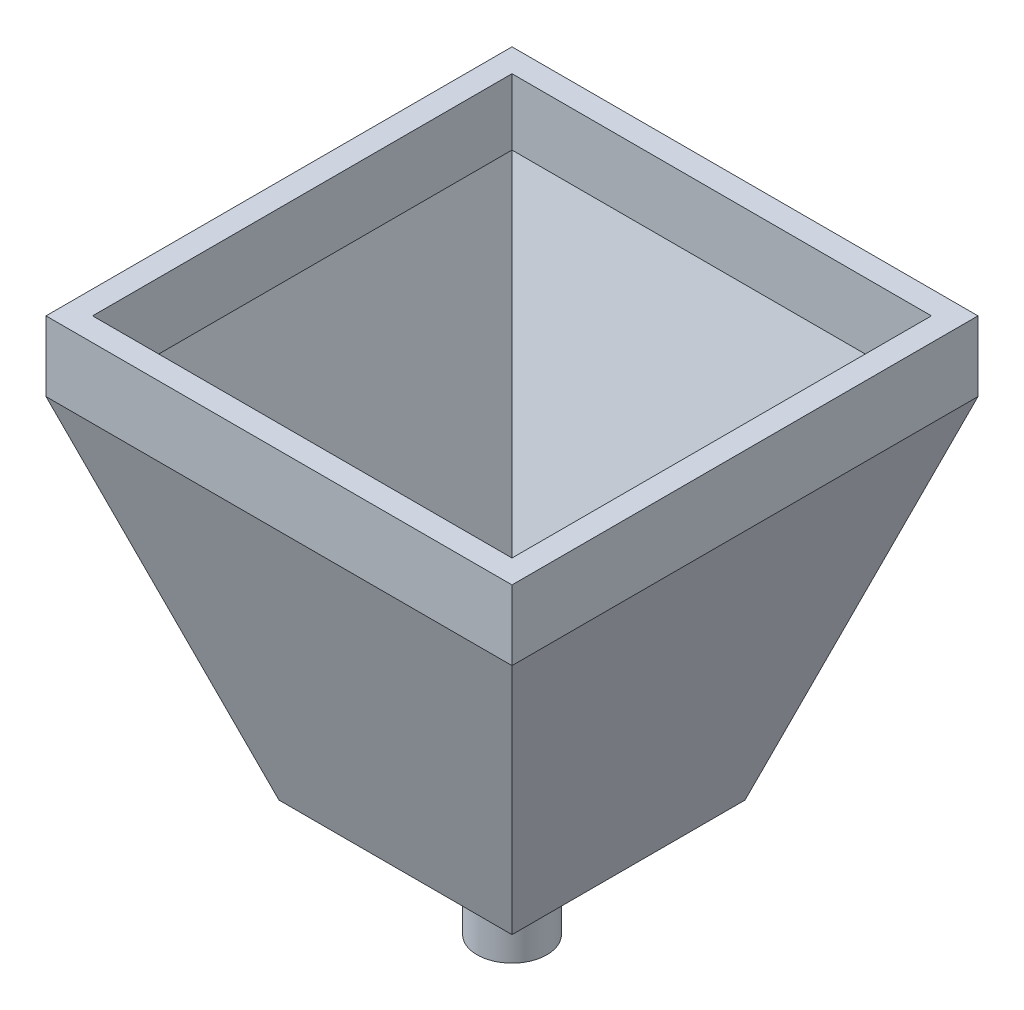
from build123d import *

# Parameters (mm, degrees)
CROQUIS3_W                 = 20
CROQUIS3_H                 = 20
SALIENTE_EXTRUIR1_DEPTH    = 3
VACIADO2_T                 = -1
CROQUIS4_R                 = 1.5
CORTAR_EXTRUIR1_DEPTH      = 3
CROQUIS5_R                 = 1.5
SALIENTE_EXTRUIR2_DEPTH    = 5
CROQUIS6_R                 = 1.355898714
CORTAR_EXTRUIR2_DEPTH      = 15
CROQUIS7_R                 = 1
SALIENTE_EXTRUIR4_DEPTH    = 1.5
CORTAR_EXTRUIR3_DEPTH      = 31.5
CORTAR_EXTRUIR3_DEPTH_BACK = 1.5
CROQUIS10_R                = 1.406391719


with BuildPart() as part:
    # Croquis2 → Recubrir1 section 0
    with BuildSketch(Plane(origin=(0, 15, 0), x_dir=(1, 0, 0), z_dir=(0, 1, 0))):
        with BuildLine():
            Line((-10, -10), (10, -10))
            Line((10, -10), (10, 10))
            Line((10, 10), (-10, 10))
            Line((-10, 10), (-10, -10))
        make_face()
    # Croquis1 → Recubrir1 section 1
    with BuildSketch(Plane(origin=(0, 0, 0), x_dir=(1, 0, 0), z_dir=(0, 1, 0))):
        with BuildLine():
            Line((-5, -5), (5, -5))
            Line((5, -5), (5, 5))
            Line((5, 5), (-5, 5))
            Line((-5, 5), (-5, -5))
        make_face()
    loft()

    # Croquis3 → Saliente-Extruir1 (add)
    with BuildSketch(Plane(origin=(0, 15, 0), x_dir=(1, 0, 0), z_dir=(0, 1, 0))):
        Rectangle(CROQUIS3_W, CROQUIS3_H)
    extrude(amount=SALIENTE_EXTRUIR1_DEPTH)

    # Vaciado2
    vaciado2_openings = [part.faces().sort_by_distance(p)[0] for p in [
        (0, 18, 0),
    ]]
    offset(amount=VACIADO2_T, openings=vaciado2_openings, kind=Kind.INTERSECTION)

    # Croquis4 → Cortar-Extruir1 (cut)
    with BuildSketch(Plane(origin=(0, 0, 0), x_dir=(-1, 0, 0), z_dir=(0, -1, 0))):
        with Locations(Location((0, 0, 0), (0, 0, 90))):
            Circle(CROQUIS4_R)
    extrude(amount=-CORTAR_EXTRUIR1_DEPTH, mode=Mode.SUBTRACT)


with BuildPart() as body_2:
    # Croquis5 → Saliente-Extruir2 (new body)
    with BuildSketch(Plane(origin=(0, 0, 0), x_dir=(-1, 0, 0), z_dir=(0, -1, 0))):
        with Locations(Location((0, 0, 0), (0, 0, 90))):
            Circle(CROQUIS5_R)
    extrude(amount=SALIENTE_EXTRUIR2_DEPTH)

    # Croquis6 → Cortar-Extruir2 (cut)
    with BuildSketch(Plane(origin=(0, -5, 0), x_dir=(-1, 0, 0), z_dir=(0, -1, 0))):
        with Locations(Location((0, 0, 0), (0, 0, 90))):
            Circle(CROQUIS6_R)
    extrude(amount=-CORTAR_EXTRUIR2_DEPTH, mode=Mode.SUBTRACT)

    # Croquis7 → Saliente-Extruir4 (add)
    with BuildSketch(Plane(origin=(0, 0, 0), x_dir=(0, 0, -1), z_dir=(1, 0, 0))):
        with Locations(Location((0, -2.4391778, 0), (0, 0, 180))):
            Circle(CROQUIS7_R)
    extrude(amount=SALIENTE_EXTRUIR4_DEPTH)

    # Croquis10 → Cortar-Extruir3 (cut, two sides: drawn at the far end of the back side and taken through both)
    with BuildSketch(Plane(origin=(0, 0, 0), x_dir=(-1, 0, 0), z_dir=(0, -1, 0)).offset(-CORTAR_EXTRUIR3_DEPTH_BACK)):
        with Locations(Location((0, 0, 0), (0, 0, 90))):
            Circle(CROQUIS10_R)
    extrude(amount=CORTAR_EXTRUIR3_DEPTH + CORTAR_EXTRUIR3_DEPTH_BACK, mode=Mode.SUBTRACT)


solid = Compound([part.part, body_2.part])
